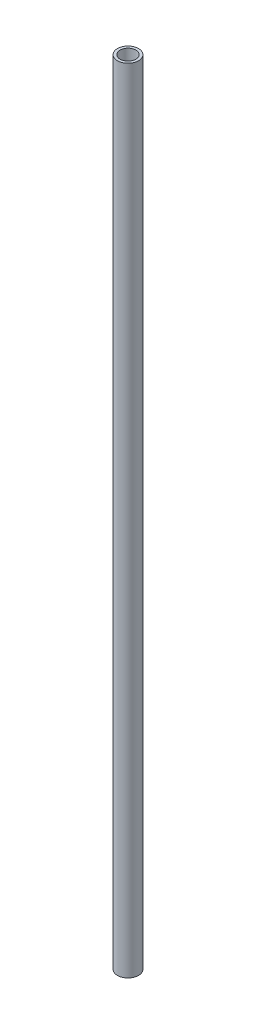
from build123d import *

# Parameters (mm, degrees)
SKETCH2_R   = 4
SKETCH2_R_2 = 3


with BuildPart() as part:
    # Sweep1: sweep along a path in Sketch1
    with BuildLine(Plane.XY) as sweep1_path:
        Line((0, 0), (0, 300))
    # Sketch2 → Sweep1 (sweep)
    with BuildSketch(Plane(origin=(0, 0, 0), x_dir=(1, 0, 0), z_dir=(0, 1, 0))):
        Circle(SKETCH2_R)
        Circle(SKETCH2_R_2, mode=Mode.SUBTRACT)
    sweep(path=sweep1_path.line)


solid = part.part
